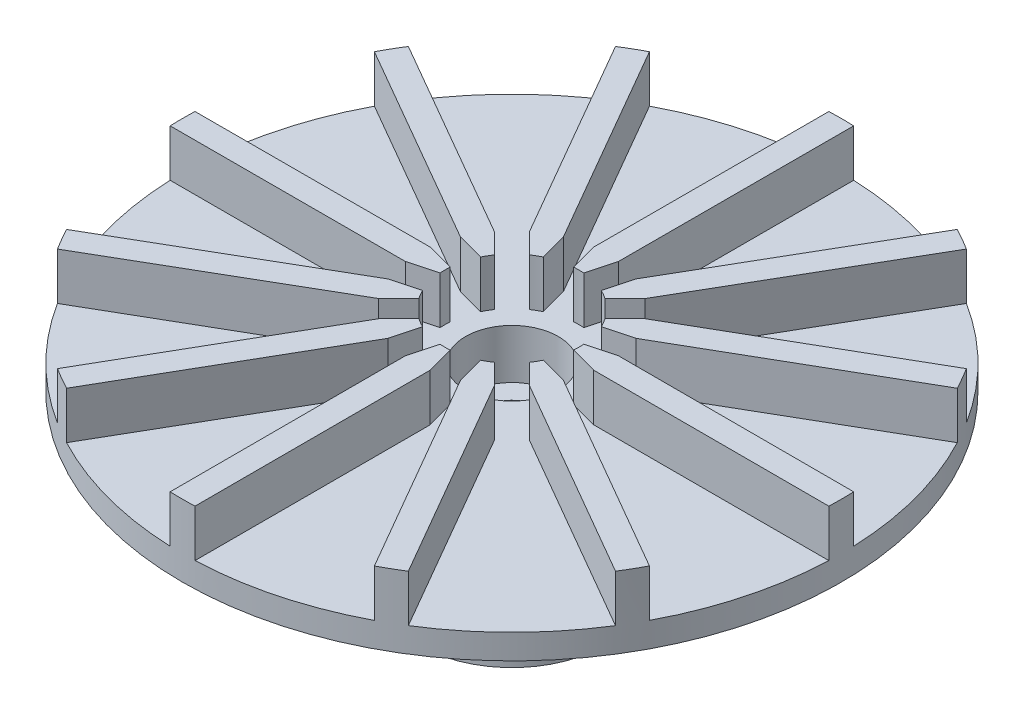
from build123d import *
from build123d.topology import SkipClean

# Parameters (mm, degrees)
SKETCH1_R              = 26.6319
BASE_DEPTH             = 2.000000064
SKETCH2_R              = 7.499999986
BOSS_DEPTH             = 13.99999994
BLADE_DEPTH            = 9.302580129
BLADE_PATTERN_COUNT    = 12
SKETCH6_R              = 4
BORE_CUT_DEPTH         = 8.99999978
DOWEL_CUT_DEPTH        = 2.000000064
SKETCH8_R              = 3.75
BOLT_HEAD_RECESS_DEPTH = 4.000000128
SKETCH9_R              = 2.000000064
BOLT_HOLE_DEPTH        = 14
F_2MM_SLOT_CUT_DEPTH   = 50.8
SLOT_PATTERN_COUNT     = 12


with BuildPart() as part:
    # Sketch1 → base (new body)
    with BuildSketch(Plane(origin=(0, 0, 0), x_dir=(1, 0, 0), z_dir=(0, 1, 0))):
        with Locations(Location((0, 0, 0), (0, 0, 270))):
            Circle(SKETCH1_R)
    extrude(amount=BASE_DEPTH)

    # Sketch2 → boss (add)
    with BuildSketch(Plane.XZ):
        with Locations(Location((0, 0, 0), (0, 0, 90))):
            Circle(SKETCH2_R)
    extrude(amount=BOSS_DEPTH)

    # Sketch3 → blade (add)
    with SkipClean():  # the faces are left unmerged after this step: merging them gives an invalid solid
        with BuildSketch(Plane(origin=(0, 2.000000064, 0), x_dir=(1, 0, 0), z_dir=(0, 1, 0))):
            with BuildLine():
                Line((5.31622381, 1.004006197), (26.612968064, 1.004006197))
                ThreePointArc((26.612968064, 1.004006197), (26.6319, 0), (26.612968064, -1.004006197))
                Line((26.612968064, -1.004006197), (5.31622381, -1.004006197))
                ThreePointArc((5.31622381, -1.004006197), (5.4102, 0), (5.31622381, 1.004006197))
            make_face()
        blade = extrude(amount=BLADE_DEPTH)

    # blade pattern: blade ×12 about axis
    with SkipClean():  # the faces are left unmerged after this step: merging them gives an invalid solid
        blade_pattern_axis = Axis((0, 0, 0), (0, 1, 0))
        for i in range(1, BLADE_PATTERN_COUNT):
            add(blade.rotate(blade_pattern_axis, i * 360 / BLADE_PATTERN_COUNT))

    # Sketch5 → angle trim (revolve, cut)
    with SkipClean():  # the faces are left unmerged after this step: merging them gives an invalid solid
        with BuildSketch(Plane.XY, mode=Mode.PRIVATE) as angle_trim_sk:
            Polygon((-26.6319, 11.302580193), (-26.6319, 5.810000064), (-5.4102, 11.302580193), align=None)
        revolve(angle_trim_sk.sketch.rotate(Axis((0, 0, 0), (0, 1, 0)), 267.839472488), axis=Axis((0, 0, 0), (0, 1, 0)), mode=Mode.SUBTRACT)

    # Sketch6 → bore_cut (cut)
    with SkipClean():  # the faces are left unmerged after this step: merging them gives an invalid solid
        with BuildSketch(Plane(origin=(0, -13.99999994, 0), x_dir=(-1, 0, 0), z_dir=(0, -1, 0))):
            with Locations(Location((0, 0, 0), (0, 0, 90))):
                Circle(SKETCH6_R)
        extrude(amount=-BORE_CUT_DEPTH, mode=Mode.SUBTRACT)

    # Sketch7 → dowel cut (cut)
    with SkipClean():  # the faces are left unmerged after this step: merging them gives an invalid solid
        with BuildSketch(Plane.XZ.offset(13.99999994)):
            with BuildLine():
                Line((-6.000000065, -1.000000032), (6.000000065, -1.000000032))
                ThreePointArc((6.000000065, -1.000000032), (7.000000097, 0), (6.000000065, 1.000000032))
                Line((6.000000065, 1.000000032), (-6.000000065, 1.000000032))
                ThreePointArc((-6.000000065, 1.000000032), (-7.000000097, 0), (-6.000000065, -1.000000032))
            make_face()
        extrude(amount=-DOWEL_CUT_DEPTH, mode=Mode.SUBTRACT)

    # Sketch8 → bolt head recess (cut)
    with SkipClean():  # the faces are left unmerged after this step: merging them gives an invalid solid
        with BuildSketch(Plane(origin=(0, 2.000000064, 0), x_dir=(1, 0, 0), z_dir=(0, 1, 0))):
            with Locations(Location((0, 0, 0), (0, 0, 270))):
                Circle(SKETCH8_R)
        extrude(amount=-BOLT_HEAD_RECESS_DEPTH, mode=Mode.SUBTRACT)

    # Sketch9 → bolt hole (cut)
    with SkipClean():  # the faces are left unmerged after this step: merging them gives an invalid solid
        with BuildSketch(Plane(origin=(0, -2.000000064, 0), x_dir=(1, 0, 0), z_dir=(0, 1, 0))):
            with Locations(Location((0, 0, 0), (0, 0, 270))):
                Circle(SKETCH9_R)
        extrude(amount=-BOLT_HOLE_DEPTH, mode=Mode.SUBTRACT)

    # Sketch11 → top angle (area based) (revolve, cut)
    with SkipClean():  # the faces are left unmerged after this step: merging them gives an invalid solid
        with BuildSketch(Plane.XY, mode=Mode.PRIVATE) as top_angle_area_based_sk:
            Polygon((0, 5.829526153), (26.6319, 5.810000064), (0, 27.400000064), align=None)
        revolve(top_angle_area_based_sk.sketch.rotate(Axis((0, 5.829526153, 0), (0, 1, 0)), 87.839472488), axis=Axis((0, 5.829526153, 0), (0, 1, 0)), mode=Mode.SUBTRACT)

    # Sketch12 → 2mm slot cut (cut)
    with SkipClean():  # the faces are left unmerged after this step: merging them gives an invalid solid
        with BuildSketch(Plane(origin=(0, 2.000000064, 0), x_dir=(1, 0, 0), z_dir=(0, 1, 0))):
            Polygon((-0.258819053, 0.965925857), (0.258819053, -0.965925857), (25.983259067, 5.92691707), (25.46562096, 7.858768784), align=None)
        f_2mm_slot_cut = extrude(amount=F_2MM_SLOT_CUT_DEPTH, mode=Mode.SUBTRACT)

    # slot pattern: 2mm slot cut ×12 about axis
    with SkipClean():  # the faces are left unmerged after this step: merging them gives an invalid solid
        slot_pattern_axis = Axis((0, 0, 0), (0, 1, 0))
        for i in range(1, SLOT_PATTERN_COUNT):
            add(f_2mm_slot_cut.rotate(slot_pattern_axis, i * 360 / SLOT_PATTERN_COUNT), mode=Mode.SUBTRACT)


solid = part.part
